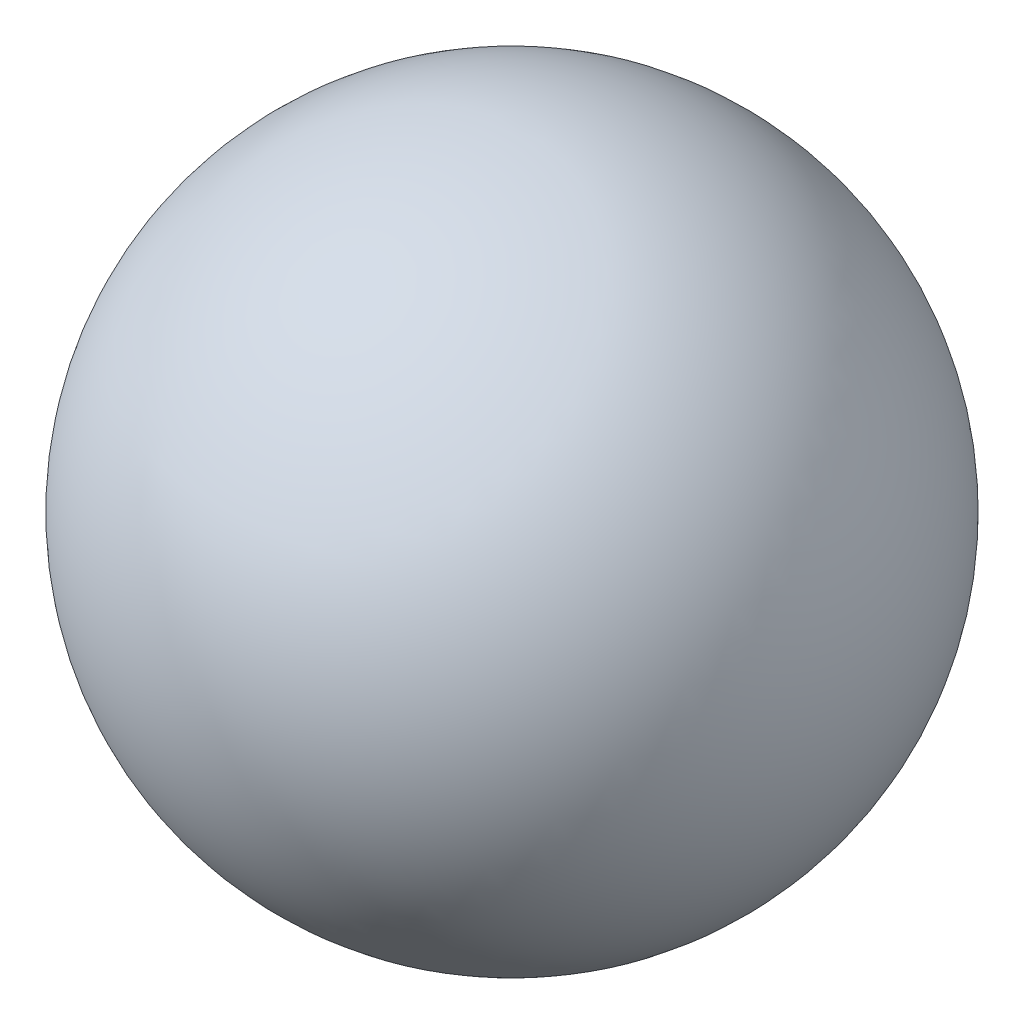
from build123d import *


with BuildPart() as part:
    # Sketch1 → Revolve4 (revolve)
    with BuildSketch(Plane.XY):
        with BuildLine():
            Line((0, -11.25), (0, 11.25))
            ThreePointArc((0, 11.25), (-11.25, 0), (0, -11.25))
        make_face()
    revolve(axis=Axis((0, -11.25, 0), (0, 1, 0)))


solid = part.part
